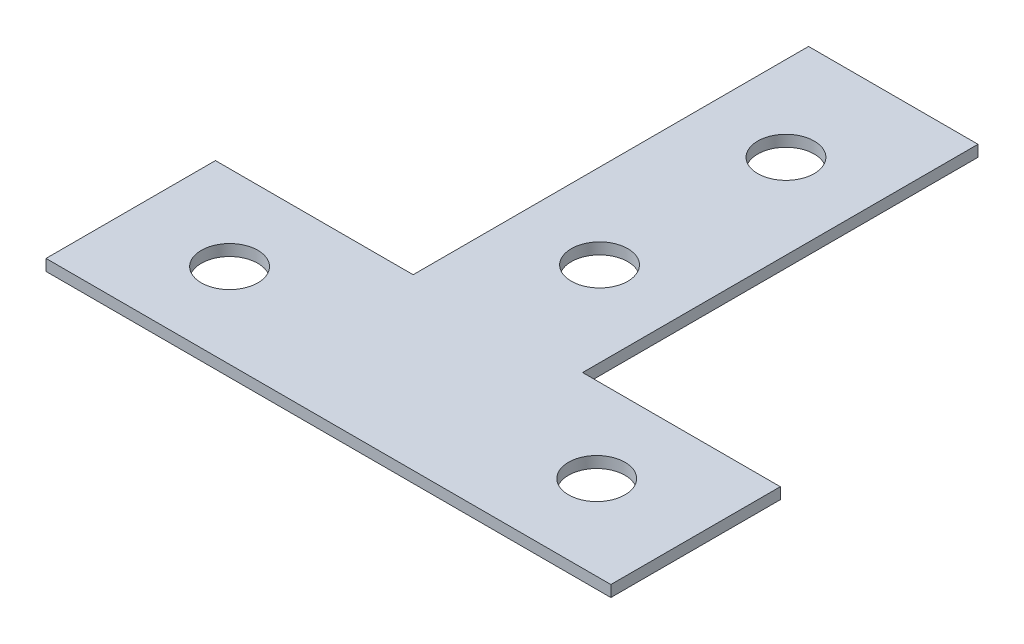
from build123d import *

# Parameters (mm, degrees)
BOSS_EXTRUDE1_DEPTH     = 1
CUT_EXTRUDE1_DEPTH      = 71.717748833
CUT_EXTRUDE1_DEPTH_BACK = 71.717748833
SKETCH2_R               = 2.5


with BuildPart() as part:
    # Sketch1 → Boss-Extrude1 (new body)
    with BuildSketch(Plane(origin=(0, 0, 0), x_dir=(1, 0, 0), z_dir=(0, 1, 0))):
        Polygon((17.5, 50), (32.5, 50), (32.5, 15), (50, 15), (50, 0), (0, 0), (0, 15), (17.5, 15), align=None)
    extrude(amount=BOSS_EXTRUDE1_DEPTH)

    # Sketch2 → Cut-Extrude1 (cut, two sides: drawn at the far end of the back side and taken through both)
    with BuildSketch(Plane(origin=(0, 1, 0), x_dir=(1, 0, 0), z_dir=(0, 1, 0)).offset(-CUT_EXTRUDE1_DEPTH_BACK)):
        with Locations(Location((41.25, 7.5, 0), (0, 0, 270))):
            Circle(SKETCH2_R)
        with Locations(Location((25, 40.5, 0), (0, 0, 270))):
            Circle(SKETCH2_R)
        with Locations(Location((25, 24, 0), (0, 0, 270))):
            Circle(SKETCH2_R)
        with Locations(Location((8.75, 7.5, 0), (0, 0, 270))):
            Circle(SKETCH2_R)
    extrude(amount=CUT_EXTRUDE1_DEPTH + CUT_EXTRUDE1_DEPTH_BACK, mode=Mode.SUBTRACT)


solid = part.part
